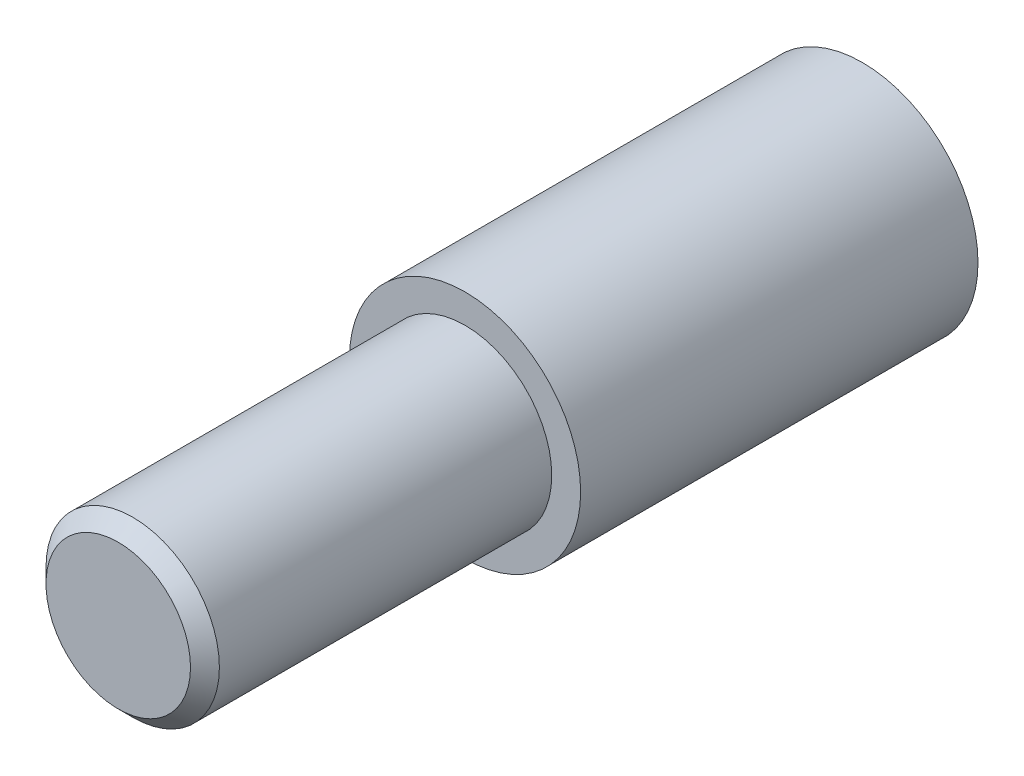
from build123d import *

# Parameters (mm, degrees)
CROQUIS1_R              = 8
SALIENTE_EXTRUIR1_DEPTH = 27.5
CROQUIS2_R              = 6
SALIENTE_EXTRUIR2_DEPTH = 24
CHAFL_N1_SIZE           = 1


with BuildPart() as part:
    # Croquis1 → Saliente-Extruir1 (new body)
    with BuildSketch(Plane.XY):
        Circle(CROQUIS1_R)
    extrude(amount=SALIENTE_EXTRUIR1_DEPTH)

    # Croquis2 → Saliente-Extruir2 (add)
    with BuildSketch(Plane.XY.offset(27.5)):
        Circle(CROQUIS2_R)
    extrude(amount=SALIENTE_EXTRUIR2_DEPTH)

    # Chaflán1
    chafl_n1_edges = [part.edges().sort_by_distance(p)[0] for p in [
        (-6, 0, 51.5),
    ]]
    chamfer(chafl_n1_edges, length=CHAFL_N1_SIZE)


solid = part.part
